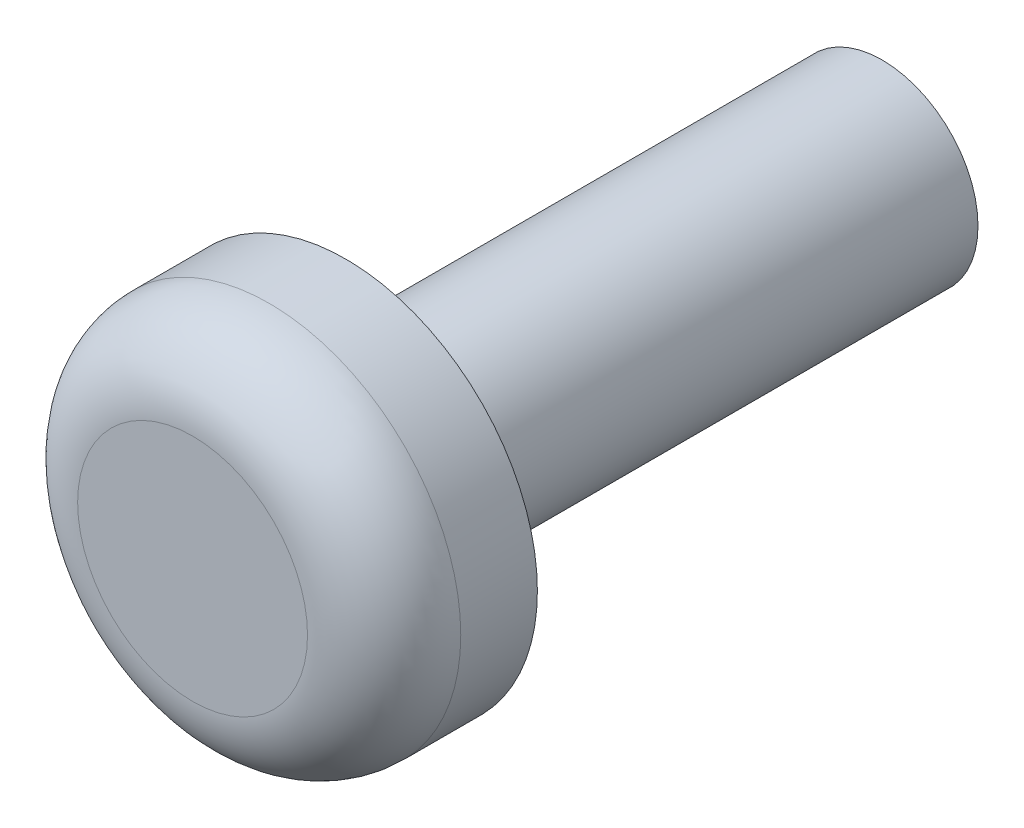
from build123d import *

# Parameters (mm, degrees)
SKETCH1_R           = 1.25
BOSS_EXTRUDE1_DEPTH = 7
SKETCH2_R           = 2.5
BOSS_EXTRUDE2_DEPTH = 2
FILLET1_R           = 1


with BuildPart() as part:
    # Sketch1 → Boss-Extrude1 (new body)
    with BuildSketch(Plane.XY):
        Circle(SKETCH1_R)
    extrude(amount=BOSS_EXTRUDE1_DEPTH)

    # Sketch2 → Boss-Extrude2 (add)
    with BuildSketch(Plane.XY.offset(7)):
        Circle(SKETCH2_R)
    extrude(amount=BOSS_EXTRUDE2_DEPTH)

    # Fillet1
    fillet1_edges = [part.edges().sort_by_distance(p)[0] for p in [
        (-2.5, 0, 9),
    ]]
    fillet(fillet1_edges, radius=FILLET1_R)


solid = part.part
